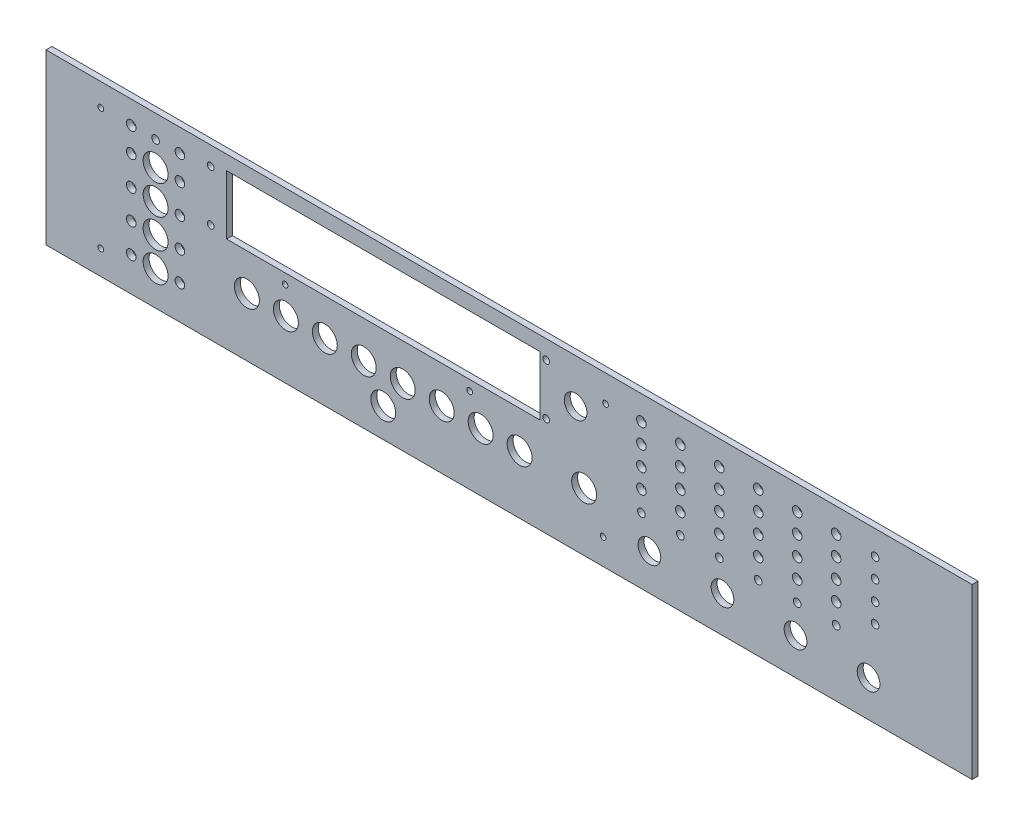
from build123d import *

# Parameters (mm, degrees)
SKETCH2_W            = 483.00005
SKETCH2_H            = 88.0999
BOSS_EXTRUDE2_DEPTH  = 3.0988
SKETCH3_W            = 163.4007
SKETCH3_H            = 30.8991
CUT_EXTRUDE1_DEPTH   = 3.0988
SKETCH5_R            = 2.5
CUT_EXTRUDE2_DEPTH   = 9.1948
LPATTERN1_COUNT      = 6
LPATTERN1_PITCH      = 20.32
LPATTERN1_COUNT_DIR2 = 4
LPATTERN1_PITCH_DIR2 = 10.16
SKETCH6_R            = 6.5024
CUT_EXTRUDE3_DEPTH   = 9.1948
LPATTERN2_COUNT      = 8
LPATTERN2_PITCH      = 20.32
SKETCH7_R            = 6.5024
CUT_EXTRUDE4_DEPTH   = 491.978862316
SKETCH8_R            = 5.92074
CUT_EXTRUDE5_DEPTH   = 491.978862316
SKETCH9_R            = 1.999996
CUT_EXTRUDE6_DEPTH   = 491.978862316
LPATTERN3_COUNT      = 6
LPATTERN3_PITCH      = 20.32
SKETCH10_R           = 2.5
CUT_EXTRUDE7_DEPTH   = 491.978862316
LPATTERN4_COUNT      = 2
LPATTERN4_PITCH      = 25.4
LPATTERN4_COUNT_DIR2 = 4
LPATTERN4_PITCH_DIR2 = 15.24
SKETCH11_R           = 1.999996
CUT_EXTRUDE8_DEPTH   = 491.978862316
LPATTERN5_COUNT      = 4
LPATTERN5_PITCH      = 10.16
SKETCH12_R           = 1.75
CUT_EXTRUDE9_DEPTH   = 491.978862316
LPATTERN6_COUNT      = 2
LPATTERN6_PITCH      = 12.7
LPATTERN6_COUNT_DIR2 = 2
LPATTERN6_PITCH_DIR2 = 25.4
SKETCH13_R           = 1.999996
CUT_EXTRUDE10_DEPTH  = 491.978862316
SKETCH15_R           = 5.92074
CUT_EXTRUDE11_DEPTH  = 491.978862316
LPATTERN7_COUNT      = 4
LPATTERN7_PITCH      = 38.1
SKETCH16_R           = 1.4732
CUT_EXTRUDE12_DEPTH  = 491.978862316
SKETCH17_R           = 1.4732
CUT_EXTRUDE13_DEPTH  = 491.978862316
SKETCH18_R           = 1.4732
CUT_EXTRUDE14_DEPTH  = 491.978862316


with BuildPart() as part:
    # Sketch2 → Boss-Extrude2 (new body)
    with BuildSketch(Plane.XY):
        with Locations((241.500025, 44.04995)):
            Rectangle(SKETCH2_W, SKETCH2_H)
    extrude(amount=-BOSS_EXTRUDE2_DEPTH)

    # Sketch3 → Cut-Extrude1 (cut)
    with BuildSketch(Plane.XY):
        with Locations((175.887888, 65.19037)):
            Rectangle(SKETCH3_W, SKETCH3_H)
    extrude(amount=-CUT_EXTRUDE1_DEPTH, mode=Mode.SUBTRACT)

    # Sketch5 → Cut-Extrude2 (cut)
    with BuildSketch(Plane.XY):
        with Locations((310.52008, 75.3999)):
            Circle(SKETCH5_R)
    cut_extrude2 = extrude(amount=-CUT_EXTRUDE2_DEPTH, mode=Mode.SUBTRACT)

    # LPattern1: Cut-Extrude2 6 × 4
    with Locations(*[(i * LPATTERN1_PITCH, -j * LPATTERN1_PITCH_DIR2, 0) for i in range(LPATTERN1_COUNT) for j in range(LPATTERN1_COUNT_DIR2) if (i, j) != (0, 0)]):
        add(cut_extrude2, mode=Mode.SUBTRACT)

    # Sketch6 → Cut-Extrude3 (cut)
    with BuildSketch(Plane.XY):
        with Locations((104.78008, 30.48)):
            Circle(SKETCH6_R)
    cut_extrude3 = extrude(amount=-CUT_EXTRUDE3_DEPTH, mode=Mode.SUBTRACT)

    # LPattern2: Cut-Extrude3 ×8
    with Locations(*[(i * LPATTERN2_PITCH, 0, 0) for i in range(1, LPATTERN2_COUNT)]):
        add(cut_extrude3, mode=Mode.SUBTRACT)

    # Sketch7 → Cut-Extrude4 (cut, through all)
    with BuildSketch(Plane.XY):
        with Locations((57.15, 48.26)):
            Circle(SKETCH7_R)
        with Locations((57.15, 33.02)):
            Circle(SKETCH7_R)
        with Locations((57.15, 17.78)):
            Circle(SKETCH7_R)
        with Locations((57.15, 63.5)):
            Circle(SKETCH7_R)
        with Locations((175.90008, 15.24)):
            Circle(SKETCH7_R)
        with Locations((280.66238, 30.48)):
            Circle(SKETCH7_R)
    extrude(amount=-CUT_EXTRUDE4_DEPTH, mode=Mode.SUBTRACT)

    # Sketch8 → Cut-Extrude5 (cut, through all)
    with BuildSketch(Plane.XY):
        with Locations((314.72505, 19.05)):
            Circle(SKETCH8_R)
    cut_extrude5 = extrude(amount=-CUT_EXTRUDE5_DEPTH, mode=Mode.SUBTRACT)

    # Sketch9 → Cut-Extrude6 (cut, through all)
    with BuildSketch(Plane.XY):
        with Locations((310.52008, 34.29)):
            Circle(SKETCH9_R)
    cut_extrude6 = extrude(amount=-CUT_EXTRUDE6_DEPTH, mode=Mode.SUBTRACT)

    # LPattern3: Cut-Extrude6 ×6
    with Locations(*[(i * LPATTERN3_PITCH, 0, 0) for i in range(1, LPATTERN3_COUNT)]):
        add(cut_extrude6, mode=Mode.SUBTRACT)

    # Sketch10 → Cut-Extrude7 (cut, through all)
    with BuildSketch(Plane.XY):
        with Locations((44.45, 63.5)):
            Circle(SKETCH10_R)
    cut_extrude7 = extrude(amount=-CUT_EXTRUDE7_DEPTH, mode=Mode.SUBTRACT)

    # LPattern4: Cut-Extrude7 2 × 4
    with Locations(*[(i * LPATTERN4_PITCH, -j * LPATTERN4_PITCH_DIR2, 0) for i in range(LPATTERN4_COUNT) for j in range(LPATTERN4_COUNT_DIR2) if (i, j) != (0, 0)]):
        add(cut_extrude7, mode=Mode.SUBTRACT)

    # Sketch11 → Cut-Extrude8 (cut, through all)
    with BuildSketch(Plane.XY):
        with Locations((432.44008, 75.3999)):
            Circle(SKETCH11_R)
    cut_extrude8 = extrude(amount=-CUT_EXTRUDE8_DEPTH, mode=Mode.SUBTRACT)

    # LPattern5: Cut-Extrude8 ×4
    with Locations(*[(0, -i * LPATTERN5_PITCH, 0) for i in range(1, LPATTERN5_COUNT)]):
        add(cut_extrude8, mode=Mode.SUBTRACT)

    # Sketch12 → Cut-Extrude9 (cut, through all)
    with BuildSketch(Plane(origin=(0, 0, -3.0988), x_dir=(-1, 0, 0), z_dir=(0, 0, -1))):
        with Locations((-260.887888, 78.44037)):
            Circle(SKETCH12_R)
        with Locations((-260.887888, 51.94037)):
            Circle(SKETCH12_R)
        with Locations((-85.887888, 78.44037)):
            Circle(SKETCH12_R)
        with Locations((-85.887888, 51.94037)):
            Circle(SKETCH12_R)
    extrude(amount=-CUT_EXTRUDE9_DEPTH, mode=Mode.SUBTRACT)

    # LPattern6: Cut-Extrude7 2 × 2
    with Locations(*[(j * LPATTERN6_PITCH_DIR2, i * LPATTERN6_PITCH, 0) for i in range(LPATTERN6_COUNT) for j in range(LPATTERN6_COUNT_DIR2) if (i, j) != (0, 0)]):
        add(cut_extrude7, mode=Mode.SUBTRACT)

    # Sketch13 → Cut-Extrude10 (cut, through all)
    with BuildSketch(Plane.XY):
        with Locations((57.15, 76.2)):
            Circle(SKETCH13_R)
    extrude(amount=-CUT_EXTRUDE10_DEPTH, mode=Mode.SUBTRACT)

    # Sketch15 → Cut-Extrude11 (cut, through all)
    with BuildSketch(Plane.XY):
        with Locations((276.23008, 65.19037)):
            Circle(SKETCH15_R)
    extrude(amount=-CUT_EXTRUDE11_DEPTH, mode=Mode.SUBTRACT)

    # LPattern7: Cut-Extrude5 ×4
    with Locations(*[(i * LPATTERN7_PITCH, 0, 0) for i in range(1, LPATTERN7_COUNT)]):
        add(cut_extrude5, mode=Mode.SUBTRACT)

    # Sketch16 → Cut-Extrude12 (cut, through all)
    with BuildSketch(Plane.XY):
        with Locations((28.575, 12.7)):
            Circle(SKETCH16_R)
        with Locations((28.575, 76.2)):
            Circle(SKETCH16_R)
    extrude(amount=-CUT_EXTRUDE12_DEPTH, mode=Mode.SUBTRACT)

    # Sketch17 → Cut-Extrude13 (cut, through all)
    with BuildSketch(Plane.XY):
        with Locations((291.846, 74.168)):
            Circle(SKETCH17_R)
        with Locations((290.576, 13.462)):
            Circle(SKETCH17_R)
    extrude(amount=-CUT_EXTRUDE13_DEPTH, mode=Mode.SUBTRACT)

    # Sketch18 → Cut-Extrude14 (cut, through all)
    with BuildSketch(Plane.XY):
        with Locations((124.714, 44.45)):
            Circle(SKETCH18_R)
        with Locations((220.98, 44.45)):
            Circle(SKETCH18_R)
    extrude(amount=-CUT_EXTRUDE14_DEPTH, mode=Mode.SUBTRACT)


solid = part.part
